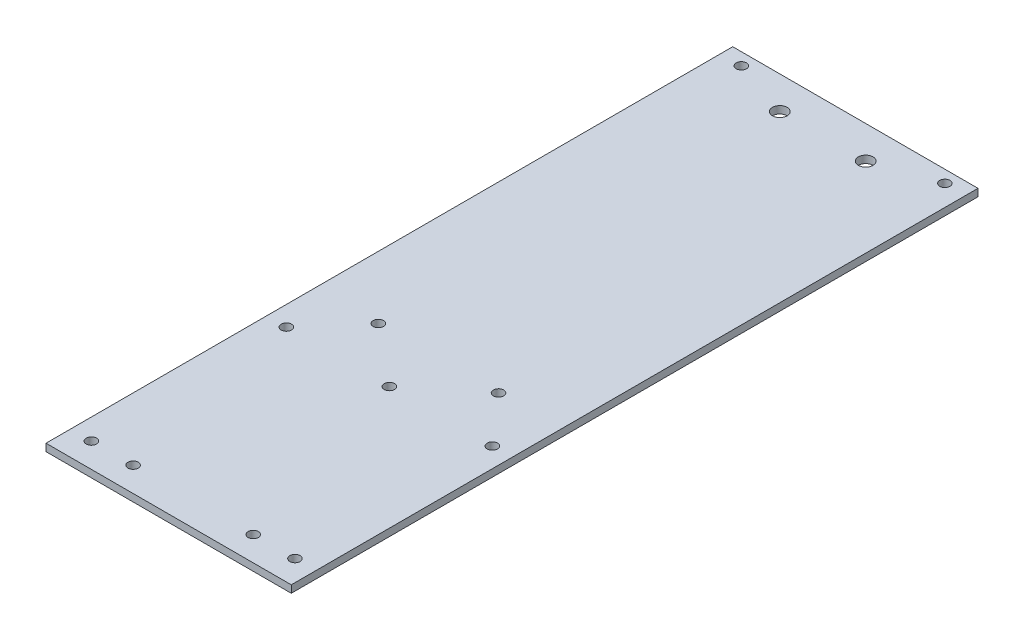
from build123d import *

# Parameters (mm, degrees)
SKETCH1_W           = 100
SKETCH1_H           = 120
SKETCH1_R           = 2.1
BOSS_EXTRUDE1_DEPTH = 3
SKETCH2_R           = 2.1
CUT_EXTRUDE1_DEPTH  = 10
SKETCH3_W           = 100
SKETCH3_H           = 3
BOSS_EXTRUDE2_DEPTH = 160
SKETCH4_R           = 3
SKETCH4_R_2         = 2.1
CUT_EXTRUDE2_DEPTH  = 160


with BuildPart() as part:
    # Sketch1 → Boss-Extrude1 (new body)
    with BuildSketch(Plane(origin=(0, 0, 0), x_dir=(1, 0, 0), z_dir=(0, 1, 0))):
        Rectangle(SKETCH1_W, SKETCH1_H)
        with Locations(Location((41.5, -50, 0), (0, 0, 90))):
            Circle(SKETCH1_R, mode=Mode.SUBTRACT)
        with Locations(Location((-41.5, -50, 0), (0, 0, 270))):
            Circle(SKETCH1_R, mode=Mode.SUBTRACT)
        with Locations(Location((-42, 30, 0), (0, 0, 270))):
            Circle(SKETCH1_R, mode=Mode.SUBTRACT)
        with Locations(Location((0, 30, 0), (0, 0, 270))):
            Circle(SKETCH1_R, mode=Mode.SUBTRACT)
        with Locations(Location((42, 30, 0), (0, 0, 270))):
            Circle(SKETCH1_R, mode=Mode.SUBTRACT)
    extrude(amount=BOSS_EXTRUDE1_DEPTH)

    # Sketch2 → Cut-Extrude1 (cut)
    with BuildSketch(Plane.XZ):
        with Locations(Location((-24.5, -50, 0), (0, 0, 270))):
            Circle(SKETCH2_R)
        with Locations(Location((24.5, -50, 0), (0, 0, 270))):
            Circle(SKETCH2_R)
        with Locations(Location((24.5, 50, 0), (0, 0, 270))):
            Circle(SKETCH2_R)
        with Locations(Location((-24.5, 50, 0), (0, 0, 270))):
            Circle(SKETCH2_R)
    extrude(amount=-CUT_EXTRUDE1_DEPTH, mode=Mode.SUBTRACT)

    # Sketch3 → Boss-Extrude2 (add)
    with BuildSketch(Plane(origin=(0, 0, -60), x_dir=(-1, 0, 0), z_dir=(0, 0, -1))):
        with Locations((0, 1.5)):
            Rectangle(SKETCH3_W, SKETCH3_H)
    extrude(amount=BOSS_EXTRUDE2_DEPTH)

    # Sketch4 → Cut-Extrude2 (cut)
    with BuildSketch(Plane.XZ):
        with Locations(Location((17.5, -206.7, 0), (0, 0, 270))):
            Circle(SKETCH4_R)
        with Locations(Location((-17.5, -206.7, 0), (0, 0, 270))):
            Circle(SKETCH4_R)
        with Locations(Location((-41.5, -215, 0), (0, 0, 270))):
            Circle(SKETCH4_R_2)
        with Locations(Location((41.5, -215, 0), (0, 0, 270))):
            Circle(SKETCH4_R_2)
    extrude(amount=-CUT_EXTRUDE2_DEPTH, mode=Mode.SUBTRACT)


solid = part.part
